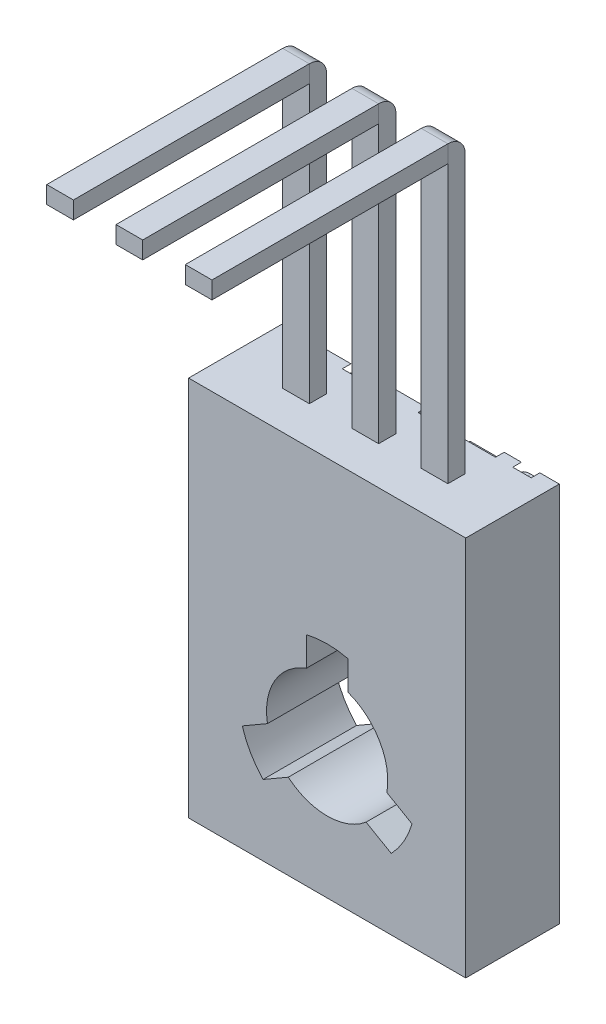
from build123d import *

# Parameters (mm, degrees)
SKETCH1_W           = 8
SKETCH1_H           = 11
SKETCH1_R           = 2.555
BOSS_EXTRUDE1_DEPTH = 1.35
SKETCH2_W           = 0.77
SKETCH2_H           = 0.5
BOSS_EXTRUDE2_DEPTH = 8
BOSS_EXTRUDE3_DEPTH = 2.7
CUT_EXTRUDE1_DEPTH  = 0.25
SKETCH6_W           = 0.77
SKETCH6_H           = 0.5


with BuildPart() as part:
    # Sketch1 → Boss-Extrude1 (new, symmetric)
    with BuildSketch(Plane.XY):
        Rectangle(SKETCH1_W, SKETCH1_H)
        with Locations(Location((0, -1.7, 0), (0, 0, 180))):
            Circle(SKETCH1_R, mode=Mode.SUBTRACT)
    extrude(amount=BOSS_EXTRUDE1_DEPTH, both=True)

    # Sketch2 → Boss-Extrude2 (add)
    with BuildSketch(Plane(origin=(0, 5.5, 0), x_dir=(1, 0, 0), z_dir=(0, 1, 0))):
        Rectangle(SKETCH2_W, SKETCH2_H)
        with Locations((-2, 0)):
            Rectangle(SKETCH2_W, SKETCH2_H)
        with Locations((2, 0)):
            Rectangle(SKETCH2_W, SKETCH2_H)
    extrude(amount=BOSS_EXTRUDE2_DEPTH)

    # Sketch4 → Boss-Extrude3 (add)
    with BuildSketch(Plane.XY.offset(1.35)):
        with BuildLine():
            Line((-0.6, 0.823242633), (-0.6, -0.056071778))
            ThreePointArc((-0.6, -0.056071778), (-1.515544457, -0.825), (-1.723683602, -2.002348869))
            Line((-1.723683602, -2.002348869), (-2.48519222, -2.442006074))
            ThreePointArc((-2.48519222, -2.442006074), (-2.246122223, -0.40320073), (-0.6, 0.823242633))
        make_face()
        with BuildLine():
            Line((0.6, 0.823242633), (0.6, -0.056071778))
            ThreePointArc((0.6, -0.056071778), (1.515544457, -0.825), (1.723683602, -2.002348869))
            Line((1.723683602, -2.002348869), (2.48519222, -2.442006074))
            ThreePointArc((2.48519222, -2.442006074), (2.246122223, -0.40320073), (0.6, 0.823242633))
        make_face()
        with BuildLine():
            Line((1.88519222, -3.481236559), (1.123683602, -3.041579353))
            ThreePointArc((1.123683602, -3.041579353), (0, -3.45), (-1.123683602, -3.041579353))
            Line((-1.123683602, -3.041579353), (-1.88519222, -3.481236559))
            ThreePointArc((-1.88519222, -3.481236559), (0, -4.29359854), (1.88519222, -3.481236559))
        make_face()
    extrude(amount=-BOSS_EXTRUDE3_DEPTH)

    # Sketch5 → Cut-Extrude1 (cut)
    # profile 1 of 5: a face of its own
    with BuildSketch(Plane(origin=(0, 0, -1.35), x_dir=(-1, 0, 0), z_dir=(0, 0, -1))):
        Polygon((3.972863248, 3.60042735), (3.972863248, 3.383333333), (2.86025641, 3.383333333), (2.86025641, 3.60042735), (3.321581197, 3.60042735), (3.321581197, 5.5), (3.511538462, 5.5), (3.511538462, 3.60042735), align=None)
    # profile 2 of 5: a face of its own
    with BuildSketch(Plane(origin=(0, 0, -1.35), x_dir=(-1, 0, 0), z_dir=(0, 0, -1))):
        with BuildLine():
            add(Edge.make_bspline(
                [(1.668952991, 3.329059829), (1.629755252, 3.330035831), (1.552767659, 3.331952778), (1.439724532, 3.347110877), (1.331481184, 3.372060207), (1.227972966, 3.407291596), (1.129602445, 3.452973264), (1.036058615, 3.508431834), (0.947663013, 3.574212354), (0.864644267, 3.648753309), (0.789188255, 3.730689393), (0.723529296, 3.818653551), (0.6676474, 3.910875311), (0.621989892, 4.007955253), (0.586113801, 4.109459945), (0.56137149, 4.215994071), (0.545563048, 4.326850183), (0.54371518, 4.402461777), (0.542777778, 4.440818643)],
                knots=[0, 0, 0, 0, 1.065027606, 2.091802087, 3.093458616, 4.079833113, 5.057734272, 6.036020118, 7.030157768, 8.047461502, 9.064242947, 10.052216774, 11.02588392, 11.989864716, 12.962978571, 13.945936472, 14.957997893, 16, 16, 16, 16], degree=3))
            add(Edge.make_bspline(
                [(0.542777778, 4.440818643), (0.543715494, 4.478892744), (0.54556384, 4.553941207), (0.561384335, 4.664096982), (0.586224139, 4.769976505), (0.621546071, 4.871333513), (0.66723721, 4.968217773), (0.723207038, 5.060504058), (0.78871848, 5.148724709), (0.86386512, 5.231059652), (0.945925864, 5.306522625), (1.033346556, 5.373233027), (1.126021706, 5.428806617), (1.22250488, 5.475146665), (1.323756301, 5.510243061), (1.429061868, 5.535818441), (1.539018674, 5.551467565), (1.613921342, 5.553327928), (1.651992521, 5.554273504)],
                knots=[0, 0, 0, 0, 1.043683505, 2.0572211, 3.045299494, 4.022276905, 4.994977706, 5.977452478, 6.97747046, 8.003698437, 9.029677512, 10.031249186, 11.013723958, 11.988083691, 12.9614021, 13.946617861, 14.956316495, 16, 16, 16, 16], degree=3))
            add(Edge.make_bspline(
                [(1.651992521, 5.554273504), (1.690349208, 5.55333662), (1.765960449, 5.551489771), (1.87695558, 5.535654452), (1.983565588, 5.510901323), (2.085462221, 5.475492857), (2.182678919, 5.429903847), (2.275206277, 5.373881723), (2.363155483, 5.307867344), (2.445631552, 5.232779717), (2.521003529, 5.150876329), (2.587297535, 5.063570422), (2.64299668, 4.971692325), (2.688604935, 4.875620778), (2.724679329, 4.775604108), (2.749298332, 4.671013173), (2.765224694, 4.562434054), (2.767060139, 4.48850627), (2.767991453, 4.450994925)],
                knots=[0, 0, 0, 0, 1.053167129, 2.076072758, 3.073341244, 4.055601477, 5.033424535, 6.017524495, 7.021518915, 8.049444456, 9.077120685, 10.074910483, 11.055688766, 12.022980584, 12.991883888, 13.970269434, 14.970104079, 16, 16, 16, 16], degree=3))
            add(Edge.make_bspline(
                [(2.767991453, 4.450994925), (2.767668422, 4.425816958), (2.767026436, 4.375778654), (2.759286145, 4.301475308), (2.748077085, 4.228358898), (2.731928714, 4.156675206), (2.711098686, 4.086412526), (2.68542921, 4.017714549), (2.65601198, 3.950015407), (2.620986705, 3.884603532), (2.582773082, 3.821376258), (2.541104965, 3.761124188), (2.495691825, 3.704923587), (2.447182378, 3.651871401), (2.394905145, 3.602873112), (2.339646896, 3.556860442), (2.281118495, 3.514309699), (2.219227379, 3.476114565), (2.155551483, 3.441031871), (2.089628838, 3.411740708), (2.022850344, 3.385851248), (1.95462779, 3.365276804), (1.885118986, 3.34890354), (1.814237039, 3.33777832), (1.742054955, 3.330020831), (1.693425153, 3.329381541), (1.668952991, 3.329059829)],
                knots=[0, 0, 0, 0, 1.037115869, 2.061148057, 3.07517727, 4.084041727, 5.086514338, 6.092668487, 7.104487461, 8.125783165, 9.147610153, 10.147694368, 11.141876323, 12.122903372, 13.107606018, 14.091946891, 15.084523921, 16.086505767, 17.087268121, 18.077809654, 19.05670789, 20.036870126, 21.011670792, 21.99694167, 22.991993299, 24, 24, 24, 24], degree=3))
        make_face()
        with BuildLine():
            add(Edge.make_bspline(
                [(1.659624733, 3.546153846), (1.679711981, 3.546397737), (1.719694441, 3.546883188), (1.779128706, 3.553317528), (1.837802597, 3.56241344), (1.895587208, 3.575657707), (1.952534217, 3.5926278), (2.008706833, 3.613583435), (2.064155219, 3.63804772), (2.118372327, 3.666445257), (2.170492289, 3.698275947), (2.220828273, 3.731836064), (2.267457888, 3.769027749), (2.311281799, 3.808471798), (2.352193685, 3.850711303), (2.390199011, 3.895435102), (2.425260334, 3.94284567), (2.45695739, 3.99274547), (2.485165207, 4.044856551), (2.510420872, 4.098182599), (2.531356849, 4.153350352), (2.547941263, 4.210015535), (2.562017631, 4.26792844), (2.57084737, 4.327404597), (2.577343358, 4.388238971), (2.577802138, 4.42935204), (2.578034188, 4.450146902)],
                knots=[0, 0, 0, 0, 1.008431664, 2.007222653, 2.999229743, 3.989431819, 4.982149843, 5.98167215, 6.998687425, 8.024288174, 9.053028776, 10.065052016, 11.06063401, 12.045759335, 13.024701188, 14.011819507, 14.991481775, 15.984022113, 16.97831254, 17.965966747, 18.945551853, 19.938269878, 20.93007375, 21.936103907, 22.956087853, 24, 24, 24, 24], degree=3))
            add(Edge.make_bspline(
                [(2.578034188, 4.450146902), (2.577261436, 4.480724311), (2.575741194, 4.540879536), (2.56248726, 4.629044475), (2.541909218, 4.713857207), (2.512074945, 4.794812213), (2.474015442, 4.872270495), (2.427590575, 4.945930613), (2.37237519, 5.015770838), (2.309692252, 5.081271279), (2.241150111, 5.141032327), (2.168403329, 5.193562601), (2.092027452, 5.237773545), (2.012462689, 5.274732901), (1.929029731, 5.302576542), (1.842263518, 5.322429045), (1.752162132, 5.335296017), (1.69076326, 5.336545706), (1.659624733, 5.337179487)],
                knots=[0, 0, 0, 0, 1.032022337, 2.030307203, 3.003823408, 3.974715386, 4.937372378, 5.913284036, 6.909147208, 7.938749767, 8.970518239, 9.975863271, 10.963918693, 11.946286286, 12.933361397, 13.927862637, 14.949112547, 16, 16, 16, 16], degree=3))
            add(Edge.make_bspline(
                [(1.659624733, 5.337179487), (1.638694142, 5.336892153), (1.597182493, 5.336322283), (1.535440227, 5.330574433), (1.474804526, 5.321375585), (1.415387622, 5.308065477), (1.357110942, 5.291628478), (1.300153014, 5.271236903), (1.244522687, 5.246804089), (1.189984351, 5.219530837), (1.137719303, 5.188771724), (1.088321072, 5.154974997), (1.041464804, 5.11904559), (0.997720883, 5.079887192), (0.956979797, 5.038003998), (0.919653712, 4.993090979), (0.884608736, 4.946035575), (0.853133999, 4.896148458), (0.824539225, 4.844449715), (0.800025481, 4.790968428), (0.779077474, 4.73604333), (0.762194272, 4.679620219), (0.748956917, 4.621829718), (0.739837661, 4.562588116), (0.733458231, 4.502015639), (0.732977417, 4.461046725), (0.732735043, 4.440394631)],
                knots=[0, 0, 0, 0, 1.047362266, 2.077233941, 3.100744636, 4.115120168, 5.122788643, 6.129711893, 7.140355774, 8.162227187, 9.180148637, 10.17298275, 11.156396779, 12.133377858, 13.108923632, 14.078087502, 15.054351192, 16.043448276, 17.028082865, 18.009331763, 18.985518559, 19.968016174, 20.954783108, 21.950335389, 22.966780876, 24, 24, 24, 24], degree=3))
            add(Edge.make_bspline(
                [(0.732735043, 4.440394631), (0.732977621, 4.419883826), (0.733458818, 4.379196867), (0.739834505, 4.319046753), (0.748966949, 4.260231715), (0.762128206, 4.202982654), (0.779091869, 4.147284973), (0.800008971, 4.093190991), (0.824674358, 4.040499165), (0.852982222, 3.989339805), (0.884802146, 3.940248238), (0.919572924, 3.893317914), (0.957892195, 3.849426224), (0.998675159, 3.807504447), (1.042902317, 3.768391073), (1.090581423, 3.732237359), (1.140525191, 3.697413836), (1.193863598, 3.666596107), (1.248711693, 3.637987907), (1.305049655, 3.613601029), (1.362172981, 3.592534717), (1.420157967, 3.575730793), (1.478904447, 3.562400574), (1.538428744, 3.553320824), (1.598708757, 3.546882496), (1.639254972, 3.5463975), (1.659624733, 3.546153846)],
                knots=[0, 0, 0, 0, 1.02988216, 2.042960975, 3.035124439, 4.018561492, 4.99104521, 5.957523397, 6.929462691, 7.91146347, 8.892205782, 9.866320947, 10.842813644, 11.816825305, 12.802668543, 13.805243666, 14.821427616, 15.858893029, 16.897256944, 17.927432741, 18.940436917, 19.95373962, 20.957947499, 21.96413624, 22.977215056, 24, 24, 24, 24], degree=3))
        make_face(mode=Mode.SUBTRACT)
    # profile 3 of 5: a face of its own
    with BuildSketch(Plane(origin=(0, 0, -1.35), x_dir=(-1, 0, 0), z_dir=(0, 0, -1))):
        Polygon((0.027773104, 3.383333333), (-0.363589744, 3.383333333), (-0.363589744, 5.5), (-0.173632479, 5.5), (-0.173632479, 3.60042735), (0.152008547, 3.60042735), align=None)
    # profile 4 of 5: a face of its own
    with BuildSketch(Plane(origin=(0, 0, -1.35), x_dir=(-1, 0, 0), z_dir=(0, 0, -1))):
        with BuildLine():
            Line((-1.242820513, 4.034615385), (-1.052863248, 4.034615385))
            add(Edge.make_bspline(
                [(-1.052863248, 4.034615385), (-1.054101077, 4.009414295), (-1.056532141, 3.959920025), (-1.067921755, 3.88775923), (-1.08420378, 3.818776871), (-1.107279207, 3.753564345), (-1.135775342, 3.691342634), (-1.170662859, 3.632937969), (-1.211198011, 3.577770693), (-1.257306436, 3.526885303), (-1.307338326, 3.480369695), (-1.360993912, 3.439776011), (-1.417721718, 3.405870729), (-1.47702971, 3.377372558), (-1.539603802, 3.356007194), (-1.604845856, 3.340147481), (-1.67305076, 3.330607056), (-1.719520626, 3.32958144), (-1.74315438, 3.329059829)],
                knots=[0, 0, 0, 0, 1.100776268, 2.161895295, 3.184016182, 4.190939212, 5.176500551, 6.166955529, 7.155448256, 8.160289653, 9.16017456, 10.133824356, 11.091467644, 12.04088621, 13.000931625, 13.972173743, 14.968683325, 16, 16, 16, 16], degree=3))
            add(Edge.make_bspline(
                [(-1.74315438, 3.329059829), (-1.766365611, 3.329598772), (-1.81197485, 3.330657775), (-1.878513057, 3.339888965), (-1.942006465, 3.354034941), (-2.001735502, 3.374997049), (-2.058313158, 3.401299909), (-2.111038906, 3.434010961), (-2.161187711, 3.471582429), (-2.206298355, 3.515899817), (-2.247737925, 3.563186583), (-2.283456328, 3.613688451), (-2.314217298, 3.665908938), (-2.339394191, 3.720255961), (-2.358479395, 3.776906501), (-2.372619703, 3.835317429), (-2.380703067, 3.896162848), (-2.381936843, 3.937352283), (-2.382564103, 3.958293269)],
                knots=[0, 0, 0, 0, 1.111674182, 2.184400057, 3.212814286, 4.223731311, 5.211378316, 6.196328225, 7.191884489, 8.207283132, 9.220262353, 10.201199469, 11.166417575, 12.120932471, 13.06540007, 14.026332106, 14.996573967, 16, 16, 16, 16], degree=3))
            add(Edge.make_bspline(
                [(-2.382564103, 3.958293269), (-2.381540066, 3.98777409), (-2.379509962, 4.046218384), (-2.362144837, 4.132103749), (-2.335022478, 4.215314299), (-2.302369827, 4.282286284), (-2.269420491, 4.336246193), (-2.239758052, 4.380696051), (-2.204835779, 4.428544003), (-2.164952032, 4.479983714), (-2.119419955, 4.534341536), (-2.069422467, 4.592726515), (-2.013668364, 4.654059074), (-1.974571334, 4.695977328), (-1.954312233, 4.717698317)],
                knots=[0, 0, 0, 0, 1.184416499, 2.348048165, 3.509039915, 4.696071444, 5.333504901, 6.05069495, 6.844171097, 7.714965912, 8.667477798, 9.695072654, 10.805644396, 12, 12, 12, 12], degree=3))
            Line((-1.954312233, 4.717698317), (-1.424721554, 5.282905983))
            Line((-1.424721554, 5.282905983), (-2.409700855, 5.282905983))
            Line((-2.409700855, 5.282905983), (-2.409700855, 5.5))
            Line((-2.409700855, 5.5), (-0.971452991, 5.5))
            Line((-0.971452991, 5.5), (-1.792339744, 4.62399172))
            add(Edge.make_bspline(
                [(-1.792339744, 4.62399172), (-1.812327262, 4.603129596), (-1.850719193, 4.563057726), (-1.904997659, 4.504536299), (-1.953826866, 4.45030891), (-1.997239207, 4.400135265), (-2.035270399, 4.354299803), (-2.067798761, 4.312443322), (-2.094968062, 4.274925021), (-2.123761859, 4.23085009), (-2.151218655, 4.176973346), (-2.17535037, 4.11146433), (-2.189959381, 4.043878805), (-2.191720819, 3.998220339), (-2.192606838, 3.975253739)],
                knots=[0, 0, 0, 0, 1.329530082, 2.553755191, 3.672934919, 4.687409497, 5.60679272, 6.413407421, 7.126401618, 7.737995624, 8.834647426, 9.90044882, 10.943907757, 12, 12, 12, 12], degree=3))
            add(Edge.make_bspline(
                [(-2.192606838, 3.975253739), (-2.192226314, 3.960809583), (-2.191476376, 3.932342926), (-2.184732436, 3.890633771), (-2.174824251, 3.850244426), (-2.159552676, 3.811674277), (-2.141204441, 3.774164723), (-2.117763218, 3.738856172), (-2.090976056, 3.704545039), (-2.059904262, 3.672407826), (-2.025793205, 3.642965149), (-1.989751703, 3.616885903), (-1.951621707, 3.595090676), (-1.911562123, 3.577223934), (-1.869685123, 3.563208335), (-1.825909581, 3.553496721), (-1.780356487, 3.547399218), (-1.749251468, 3.546574219), (-1.73340211, 3.546153846)],
                knots=[0, 0, 0, 0, 0.991504627, 1.954065223, 2.895985987, 3.842598665, 4.797835564, 5.759220273, 6.74786863, 7.784730864, 8.824135544, 9.839918996, 10.835834653, 11.835434876, 12.84861661, 13.863796685, 14.911511676, 16, 16, 16, 16], degree=3))
            add(Edge.make_bspline(
                [(-1.73340211, 3.546153846), (-1.716845045, 3.546569076), (-1.684329703, 3.54738452), (-1.636692568, 3.55356491), (-1.590930223, 3.562924794), (-1.54774785, 3.577825654), (-1.506241722, 3.595265163), (-1.467470678, 3.61784626), (-1.430345593, 3.643648655), (-1.395612877, 3.673732609), (-1.363978879, 3.707692862), (-1.335201147, 3.744657997), (-1.31081749, 3.785283331), (-1.289172363, 3.828594048), (-1.272618114, 3.875780072), (-1.258465418, 3.92568741), (-1.248185105, 3.979028124), (-1.24463841, 4.015778548), (-1.242820513, 4.034615385)],
                knots=[0, 0, 0, 0, 1.031072318, 2.024855787, 2.988461151, 3.935103592, 4.865765533, 5.788564469, 6.724086513, 7.67908574, 8.64457978, 9.611397706, 10.591395687, 11.591555111, 12.622101007, 13.700900657, 14.821571223, 16, 16, 16, 16], degree=3))
        make_face()
    # profile 5 of 5: a face of its own
    with BuildSketch(Plane(origin=(0, 0, -1.35), x_dir=(-1, 0, 0), z_dir=(0, 0, -1))):
        with BuildLine():
            Line((-3.397478632, 3.329059829), (-3.543762687, 3.443967014))
            Line((-3.543762687, 3.443967014), (-2.984491186, 4.299198718))
            add(Edge.make_bspline(
                [(-2.984491186, 4.299198718), (-3.021726544, 4.293263669), (-3.09435832, 4.281686685), (-3.167876744, 4.27977688), (-3.203705262, 4.278846154)],
                knots=[0, 0, 0, 0, 1.025318673, 2, 2, 2, 2], degree=3))
            add(Edge.make_bspline(
                [(-3.203705262, 4.278846154), (-3.225218152, 4.279424374), (-3.267565638, 4.280562582), (-3.329739274, 4.289321864), (-3.389483062, 4.303125621), (-3.446549362, 4.323247418), (-3.501143054, 4.348951208), (-3.55357724, 4.37975715), (-3.602867009, 4.41725562), (-3.649644292, 4.459145209), (-3.69212153, 4.505537806), (-3.729699496, 4.554776767), (-3.761437227, 4.606858199), (-3.786722854, 4.661770389), (-3.806930547, 4.719083492), (-3.821315965, 4.779021033), (-3.829915785, 4.841684174), (-3.831076871, 4.884307959), (-3.831666667, 4.905959535)],
                knots=[0, 0, 0, 0, 1.043709831, 2.054511743, 3.041122595, 4.01515914, 4.98481438, 5.965901842, 6.960491961, 7.985277438, 9.0096037, 10.00832444, 10.987059228, 11.962929573, 12.936966118, 13.931840027, 14.949438142, 16, 16, 16, 16], degree=3))
            add(Edge.make_bspline(
                [(-3.831666667, 4.905959535), (-3.830564127, 4.935564083), (-3.82839587, 4.993784478), (-3.812552535, 5.078917729), (-3.785412066, 5.159323486), (-3.74851777, 5.235211696), (-3.701561796, 5.304993099), (-3.64524165, 5.367847061), (-3.579835392, 5.42263308), (-3.506645298, 5.46961113), (-3.427441589, 5.506940502), (-3.344391084, 5.534537493), (-3.258207089, 5.551027708), (-3.199676176, 5.553186596), (-3.170208333, 5.554273504)],
                knots=[0, 0, 0, 0, 1.0319111, 2.029359566, 3.00642934, 3.98275322, 4.962714161, 5.929339302, 6.915525103, 7.928435063, 8.953439721, 9.960121214, 10.9730072, 12, 12, 12, 12], degree=3))
            add(Edge.make_bspline(
                [(-3.170208333, 5.554273504), (-3.141724839, 5.553351932), (-3.085304023, 5.55152646), (-3.002328471, 5.535180041), (-2.922457509, 5.508873915), (-2.84671823, 5.471871925), (-2.776435443, 5.425925627), (-2.713074062, 5.37098903), (-2.65823736, 5.307026502), (-2.612434968, 5.235231601), (-2.574953238, 5.158691702), (-2.5487642, 5.078014061), (-2.531736833, 4.994870697), (-2.529984581, 4.938267529), (-2.529102564, 4.909775641)],
                knots=[0, 0, 0, 0, 1.01206923, 2.004731945, 2.994948482, 3.995280086, 4.993424783, 5.973125358, 6.967517142, 7.97830003, 8.994392566, 9.989381197, 10.98793077, 12, 12, 12, 12], degree=3))
            add(Edge.make_bspline(
                [(-2.529102564, 4.909775641), (-2.529869673, 4.887985187), (-2.531435267, 4.843513042), (-2.540778548, 4.775963896), (-2.557915268, 4.707117459), (-2.576460943, 4.648754517), (-2.594863852, 4.600419426), (-2.611927453, 4.562250482), (-2.631006637, 4.521942851), (-2.653370098, 4.480259194), (-2.677077172, 4.436008518), (-2.704769724, 4.390829561), (-2.733667328, 4.343072248), (-2.754836976, 4.311276171), (-2.765701122, 4.2949586)],
                knots=[0, 0, 0, 0, 1.17367173, 2.395347028, 3.66355231, 4.98980831, 5.690886799, 6.447442954, 7.240630024, 8.091733897, 8.994365608, 9.943299771, 10.944512865, 12, 12, 12, 12], degree=3))
            Line((-2.765701122, 4.2949586), (-3.397478632, 3.329059829))
        make_face()
        with BuildLine():
            add(Edge.make_bspline(
                [(-3.163848157, 4.495940171), (-3.147722758, 4.496412355), (-3.116084857, 4.497338775), (-3.069753126, 4.502686575), (-3.025876911, 4.512474541), (-2.984528211, 4.526252073), (-2.945096799, 4.543084659), (-2.908209011, 4.564430456), (-2.873616591, 4.58953265), (-2.842118391, 4.618424934), (-2.813187678, 4.649574996), (-2.788304451, 4.683144881), (-2.766816273, 4.718102483), (-2.749351121, 4.754778061), (-2.735749585, 4.793147646), (-2.725911274, 4.833037407), (-2.720435881, 4.874714121), (-2.719524974, 4.902976163), (-2.719059829, 4.917407853)],
                knots=[0, 0, 0, 0, 1.129540697, 2.216149546, 3.260829642, 4.271906843, 5.264942922, 6.258225651, 7.250175744, 8.252297429, 9.247108021, 10.223125336, 11.173816288, 12.116901384, 13.062424938, 14.020354563, 14.989116641, 16, 16, 16, 16], degree=3))
            add(Edge.make_bspline(
                [(-2.719059829, 4.917407853), (-2.719453018, 4.931707418), (-2.720227844, 4.959886465), (-2.726794355, 5.001259793), (-2.737364396, 5.040946988), (-2.75239049, 5.079031769), (-2.771586721, 5.11545623), (-2.794546424, 5.150660697), (-2.822387043, 5.183708071), (-2.85401457, 5.21480231), (-2.888381529, 5.24325608), (-2.924651443, 5.268695435), (-2.962954452, 5.289810603), (-3.00288264, 5.307459885), (-3.044937628, 5.320426274), (-3.088407238, 5.330360005), (-3.133890491, 5.335789342), (-3.164683163, 5.336710024), (-3.180384615, 5.337179487)],
                knots=[0, 0, 0, 0, 0.98953633, 1.950002717, 2.892353065, 3.828177645, 4.777967117, 5.738732544, 6.732276577, 7.76327951, 8.805689376, 9.818183401, 10.825652611, 11.829169732, 12.834974292, 13.867693979, 14.912718532, 16, 16, 16, 16], degree=3))
            add(Edge.make_bspline(
                [(-3.180384615, 5.337179487), (-3.196086094, 5.33671006), (-3.226878816, 5.33578945), (-3.272361703, 5.330359593), (-3.315832665, 5.320427781), (-3.357882741, 5.307454422), (-3.397829145, 5.289830991), (-3.436165665, 5.268562336), (-3.472781888, 5.243410298), (-3.507126496, 5.214753106), (-3.538886011, 5.183884461), (-3.566086894, 5.150358613), (-3.589787041, 5.115733285), (-3.608251182, 5.07888689), (-3.623445515, 5.040969636), (-3.633963773, 5.001253612), (-3.640544283, 4.959888078), (-3.641317188, 4.931707961), (-3.641709402, 4.917407853)],
                knots=[0, 0, 0, 0, 1.087095469, 2.131941252, 3.164484274, 4.170116773, 5.173462224, 6.180759088, 7.201132453, 8.243363996, 9.274190558, 10.261329848, 11.227346438, 12.172477233, 13.108141724, 14.050330866, 15.010632948, 16, 16, 16, 16], degree=3))
            add(Edge.make_bspline(
                [(-3.641709402, 4.917407853), (-3.641380484, 4.902955661), (-3.640734927, 4.874590709), (-3.633291915, 4.833074956), (-3.623238891, 4.792823276), (-3.606992272, 4.754742435), (-3.587641261, 4.717779227), (-3.562989198, 4.68299053), (-3.534725561, 4.64938904), (-3.501991346, 4.618218458), (-3.466387672, 4.589687184), (-3.428495545, 4.564577282), (-3.38901308, 4.543142688), (-3.347382207, 4.526229266), (-3.304163565, 4.512603574), (-3.25905859, 4.502752135), (-3.212035237, 4.497330449), (-3.180115105, 4.496409499), (-3.163848157, 4.495940171)],
                knots=[0, 0, 0, 0, 0.978317929, 1.920119929, 2.851929572, 3.784133089, 4.71845084, 5.67514162, 6.667477147, 7.690549442, 8.733345855, 9.756283585, 10.767808623, 11.772962645, 12.797066014, 13.836159554, 14.89727653, 16, 16, 16, 16], degree=3))
        make_face(mode=Mode.SUBTRACT)
    extrude(amount=-CUT_EXTRUDE1_DEPTH, mode=Mode.SUBTRACT)

    # Sweep1: sweep along a path in Sketch7
    with BuildLine(Plane(origin=(0, 0, 0), x_dir=(0, 0, -1), z_dir=(1, 0, 0))) as sweep1_path:
        Line((-7.060834301, 13.75), (-0.25, 13.75))
        ThreePointArc((-0.25, 13.75), (-0.073223305, 13.676776695), (0, 13.5))
    # Sketch6 → Sweep1 (sweep)
    with BuildSketch(Plane(origin=(0, 13.5, 0), x_dir=(1, 0, 0), z_dir=(0, 1, 0))):
        with Locations((2, 0)):
            Rectangle(SKETCH6_W, SKETCH6_H)
        Rectangle(SKETCH6_W, SKETCH6_H)
        with Locations((-2, 0)):
            Rectangle(SKETCH6_W, SKETCH6_H)
    sweep(path=sweep1_path.line)


solid = part.part
